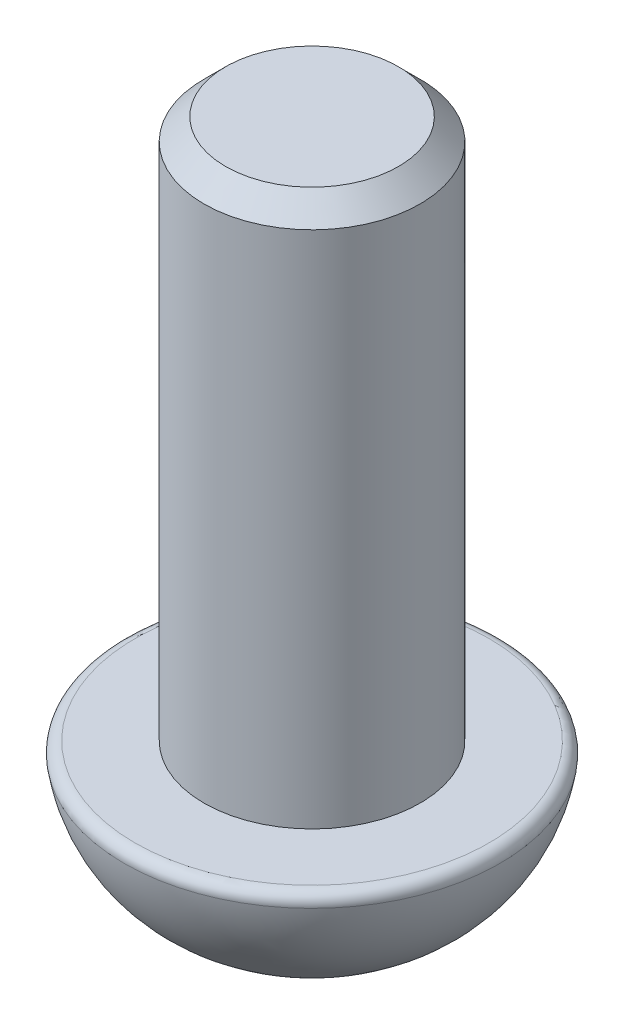
from build123d import *

# Parameters (mm, degrees)
SKETCH1_R           = 1.75
BOSS_EXTRUDE1_DEPTH = 1.3
SKETCH2_R           = 1
BOSS_EXTRUDE2_DEPTH = 5
CUT_EXTRUDE1_DEPTH  = 0.8
CHAMFER1_SIZE       = 0.2
FILLET1_R           = 0.1


with BuildPart() as part:
    # Sketch1 → Boss-Extrude1 (new body)
    with BuildSketch(Plane(origin=(0, 0, 0), x_dir=(1, 0, 0), z_dir=(0, 1, 0))):
        with Locations(Location((0, 0, 0), (0, 0, 270))):
            Circle(SKETCH1_R)
    extrude(amount=BOSS_EXTRUDE1_DEPTH)

    # Sketch2 → Boss-Extrude2 (add)
    with BuildSketch(Plane(origin=(0, 1.3, 0), x_dir=(1, 0, 0), z_dir=(0, 1, 0))):
        with Locations(Location((0, 0, 0), (0, 0, 270))):
            Circle(SKETCH2_R)
    extrude(amount=BOSS_EXTRUDE2_DEPTH)

    # Sketch3 → Cut-Extrude1 (cut)
    with BuildSketch(Plane.XZ):
        Polygon((0, -0.75055535), (0.65, -0.375277675), (0.65, 0.375277675), (0, 0.75055535), (-0.65, 0.375277675), (-0.65, -0.375277675), align=None)
    extrude(amount=-CUT_EXTRUDE1_DEPTH, mode=Mode.SUBTRACT)

    # Chamfer1
    chamfer1_edges = [part.edges().sort_by_distance(p)[0] for p in [
        (0, 6.3, -1),
    ]]
    chamfer(chamfer1_edges, length=CHAMFER1_SIZE)

    # Sketch4 → Cut-Revolve1 (revolve, cut)
    with BuildSketch(Plane(origin=(0, 0, 0), x_dir=(0, 0, -1), z_dir=(1, 0, 0)), mode=Mode.PRIVATE) as cut_revolve1_sk:
        with BuildLine():
            Line((1.75, 1.3), (1.75, 0))
            Line((1.75, 0), (0.75055535, 0))
            ThreePointArc((0.75055535, 0), (1.443641612, 0.501341114), (1.75, 1.3))
        make_face()
    revolve(cut_revolve1_sk.sketch.rotate(Axis((0, 6.3, 0), (0, -1, 0)), 180), axis=Axis((0, 6.3, 0), (0, -1, 0)), mode=Mode.SUBTRACT)

    # Fillet1
    fillet1_edges = [part.edges().sort_by_distance(p)[0] for p in [
        (0, 1.3, -1.75),
    ]]
    fillet(fillet1_edges, radius=FILLET1_R)


solid = part.part
